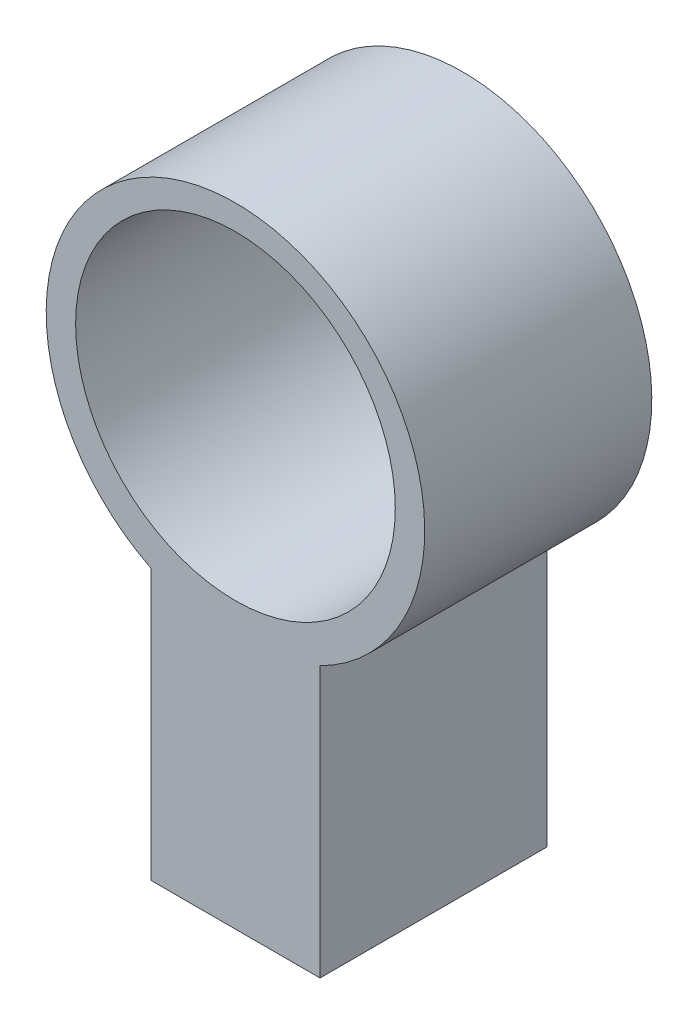
from build123d import *

# Parameters (mm, degrees)
RESSALTO_EXTRUS_O1_DEPTH = 18
ESBO_O3_R                = 12.668025565
CORTE_EXTRUS_O2_DEPTH    = 58.275422957


with BuildPart() as part:
    # Esboço1 → Ressalto-extrusão1 (new body)
    with BuildSketch(Plane.XY):
        with BuildLine():
            Line((0, 0), (0, 21.43532158))
            ThreePointArc((0, 21.43532158), (6.703057614, 49.854301371), (13.406115228, 21.43532158))
            Line((13.406115228, 21.43532158), (13.406115228, 0))
            Line((13.406115228, 0), (0, 0))
        make_face()
    extrude(amount=RESSALTO_EXTRUS_O1_DEPTH)

    # Esboço3 → Corte-extrusão2 (cut, through all)
    with BuildSketch(Plane.XY.offset(18)):
        with Locations((6.703057614, 35.210084405)):
            Circle(ESBO_O3_R)
    extrude(amount=-CORTE_EXTRUS_O2_DEPTH, mode=Mode.SUBTRACT)


solid = part.part
